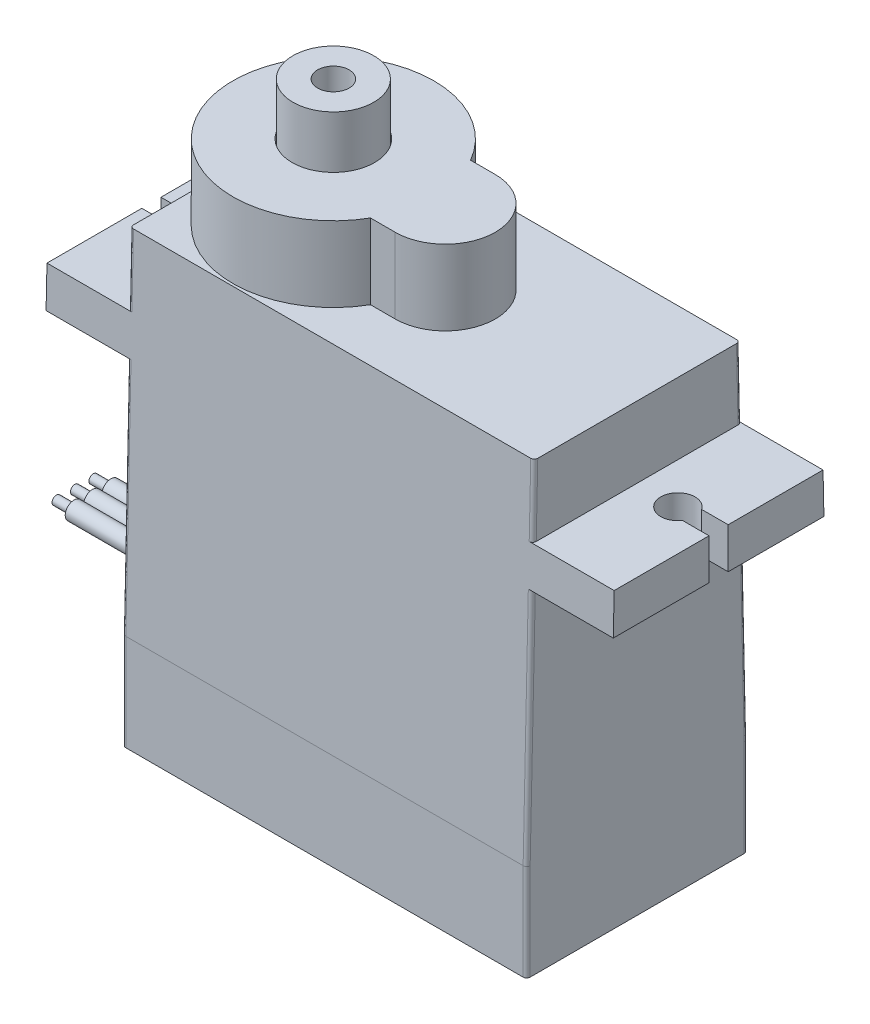
from build123d import *

# Parameters (mm, degrees)
BOSS_EXTRUDE1_DEPTH      = 6.295
BOSS_EXTRUDE2_DEPTH      = 4.28
CUT_EXTRUDE4_DEPTH       = 39.007408817
SKETCH4_R                = 0.975
SKETCH4_W                = 1.511544683
SKETCH4_H                = 1.09
CUT_EXTRUDE1_DEPTH       = 29.67958551
SKETCH5_R                = 1
SKETCH5_R_2              = 0.975
CUT_EXTRUDE2_DEPTH       = 1
SKETCH6_R                = 0.5
BOSS_EXTRUDE4_DEPTH      = 8
SKETCH7_R                = 0.25
BOSS_EXTRUDE5_DEPTH      = 1
FILLET1_R                = 0.3
FILLET3_R                = 0.2
BOSS_EXTRUDE6_DEPTH      = 2.95
BOSS_EXTRUDE6_DEPTH_BACK = 1
SKETCH12_R               = 2.3
SKETCH12_R_2             = 0.9
SKETCH13_R               = 2.35
CUT_EXTRUDE5_DEPTH       = 5


with BuildPart() as part:
    # Sketch1 → Boss-Extrude1 (new, symmetric)
    with BuildSketch(Plane.XY):
        Polygon((-7.13, 6.38), (15.9, 6.38), (15.9, 2.32), (20.54, 2.32), (20.54, 0), (15.9, 0), (15.9, -19), (-7.13, -19), (-7.13, 0), (-11.77, 0), (-11.77, 2.32), (-7.13, 2.32), align=None)
    extrude(amount=BOSS_EXTRUDE1_DEPTH, both=True)

    # Sketch2 → Boss-Extrude2 (add)
    with BuildSketch(Plane(origin=(0, 6.38, 0), x_dir=(1, 0, 0), z_dir=(0, 1, 0))):
        with BuildLine():
            Line((3.560191336, -2.85), (4.97, -2.85))
            ThreePointArc((4.97, -2.85), (7.82, 0), (4.97, 2.85))
            Line((4.97, 2.85), (3.560191336, 2.85))
            ThreePointArc((3.560191336, 2.85), (-7.13, 0), (3.560191336, -2.85))
        make_face()
    extrude(amount=BOSS_EXTRUDE2_DEPTH)

    # Sketch11 → Cut-Extrude4 (cut, through all)
    with BuildSketch(Plane.ZY.offset(11.77)):
        Polygon((-5.86, 6.38), (-6.295, -13.5), (-6.295, 6.38), align=None)
    cut_extrude4 = extrude(amount=-CUT_EXTRUDE4_DEPTH, mode=Mode.SUBTRACT)

    # Mirror1: Cut-Extrude4 across plane
    add(cut_extrude4.mirror(Plane.XY), mode=Mode.SUBTRACT)

    # Sketch4 → Cut-Extrude1 (cut, through all)
    with BuildSketch(Plane(origin=(0, 0, 0), x_dir=(1, 0, 0), z_dir=(0, 1, 0))):
        with Locations((-9.45, 0)):
            Circle(SKETCH4_R)
        with Locations((-11.014227659, 0)):
            Rectangle(SKETCH4_W, SKETCH4_H)
    cut_extrude1 = extrude(amount=CUT_EXTRUDE1_DEPTH, mode=Mode.SUBTRACT)

    # Mirror2: Cut-Extrude1 across plane
    add(cut_extrude1.mirror(Plane(origin=(4.385, -13.5, 6.295), x_dir=(0, 0, 1), z_dir=(-1, 0, 0))), mode=Mode.SUBTRACT)

    # Sketch5 → Cut-Extrude2 (cut)
    # profile 1 of 4: a face of its own
    with BuildSketch(Plane.XZ.offset(19)):
        with Locations((-5.49, 4.35)):
            Circle(SKETCH5_R)
        with Locations((-5.49, 4.35)):
            Circle(SKETCH5_R_2, mode=Mode.SUBTRACT)
    # profile 2 of 4: a face of its own
    with BuildSketch(Plane.XZ.offset(19)):
        with Locations((-5.49, -4.35)):
            Circle(SKETCH5_R)
        with Locations((-5.49, -4.35)):
            Circle(SKETCH5_R_2, mode=Mode.SUBTRACT)
    # profile 3 of 4: a face of its own
    with BuildSketch(Plane.XZ.offset(19)):
        with Locations((14.26, -4.35)):
            Circle(SKETCH5_R)
        with Locations((14.26, -4.35)):
            Circle(SKETCH5_R_2, mode=Mode.SUBTRACT)
    # profile 4 of 4: a face of its own
    with BuildSketch(Plane.XZ.offset(19)):
        with Locations((14.26, 4.35)):
            Circle(SKETCH5_R)
        with Locations((14.26, 4.35)):
            Circle(SKETCH5_R_2, mode=Mode.SUBTRACT)
    extrude(amount=-CUT_EXTRUDE2_DEPTH, mode=Mode.SUBTRACT)

    # Sketch6 → Boss-Extrude4 (add)
    with BuildSketch(Plane.ZY.offset(7.13)):
        with Locations((0, -14)):
            Circle(SKETCH6_R)
        with Locations((1.05, -14)):
            Circle(SKETCH6_R)
        with Locations((-1.05, -14)):
            Circle(SKETCH6_R)
    extrude(amount=BOSS_EXTRUDE4_DEPTH)

    # Sketch7 → Boss-Extrude5 (add)
    with BuildSketch(Plane.ZY.offset(15.13)):
        with Locations((0, -14)):
            Circle(SKETCH7_R)
        with Locations((1.05, -14)):
            Circle(SKETCH7_R)
        with Locations((-1.05, -14)):
            Circle(SKETCH7_R)
    extrude(amount=BOSS_EXTRUDE5_DEPTH)

    # Fillet1
    fillet1_edges = [part.edges().sort_by_distance(p)[0] for p in [
        (13.285, -19, -4.35),
        (13.285, -19, 4.35),
        (-6.465, -19, -4.35),
        (-6.465, -19, 4.35),
    ]]
    fillet(fillet1_edges, radius=FILLET1_R)

    # Fillet3
    fillet3_edges = [part.edges().sort_by_distance(p)[0] for p in [
        (15.9, -16.25, -6.295),
        (15.9, -16.25, 6.295),
        (-7.13, -16.25, -6.295),
        (-7.13, -16.25, 6.295),
        (-7.13, -6.75, 6.147301308),
        (-7.13, -6.75, -6.147301308),
        (15.9, -6.75, 6.147301308),
        (15.9, -6.75, -6.147301308),
        (15.9, 4.35, -5.904419014),
        (15.9, 4.35, 5.904419014),
        (-7.13, 4.35, -5.904419014),
        (-7.13, 4.35, 5.904419014),
    ]]
    fillet(fillet3_edges, radius=FILLET3_R)

    # Sketch13 → Cut-Extrude5 (cut)
    with BuildSketch(Plane(origin=(0, 13.61, 0), x_dir=(1, 0, 0), z_dir=(0, 1, 0))):
        with Locations((-1.405, 0)):
            Circle(SKETCH13_R)
    extrude(amount=-CUT_EXTRUDE5_DEPTH, mode=Mode.SUBTRACT)


with BuildPart() as body_2:
    # Sketch12 → Boss-Extrude6 (new, two sides: drawn at the far end of the back side and taken through both)
    with BuildSketch(Plane(origin=(0, 10.66, 0), x_dir=(1, 0, 0), z_dir=(0, 1, 0)).offset(-BOSS_EXTRUDE6_DEPTH_BACK)):
        with Locations((-1.405, 0)):
            Circle(SKETCH12_R)
        with Locations((-1.405, 0)):
            Circle(SKETCH12_R_2, mode=Mode.SUBTRACT)
    extrude(amount=BOSS_EXTRUDE6_DEPTH + BOSS_EXTRUDE6_DEPTH_BACK)


solid = Compound([part.part, body_2.part])
